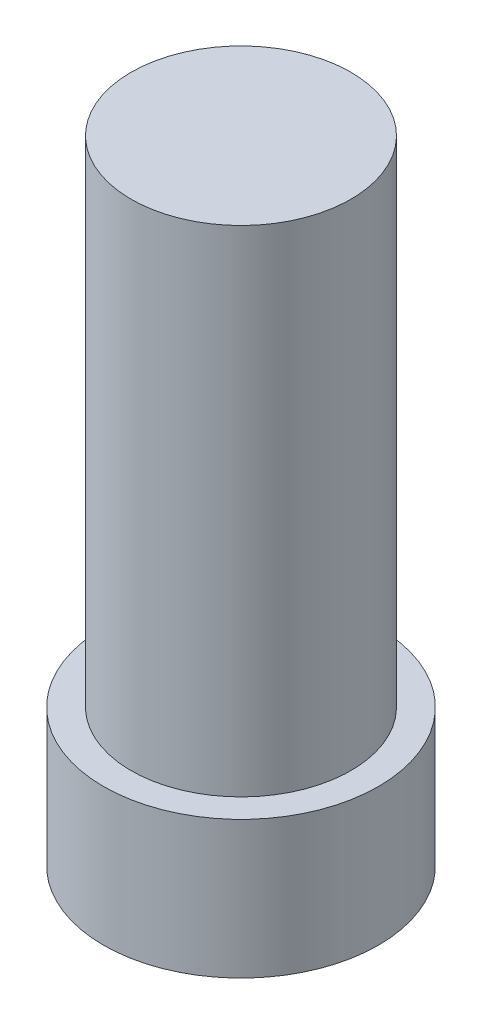
from build123d import *


with BuildPart() as part:
    # Sketch1 → Revolve1 (revolve)
    with BuildSketch(Plane.XY, mode=Mode.PRIVATE) as revolve1_sk:
        Polygon((0, 0), (4, 0), (4, -18), (5, -18), (5, -23), (0, -23), align=None)
    revolve(revolve1_sk.sketch.rotate(Axis((0, 5, 0), (0, -1, 0)), 180), axis=Axis((0, 5, 0), (0, -1, 0)))


solid = part.part
